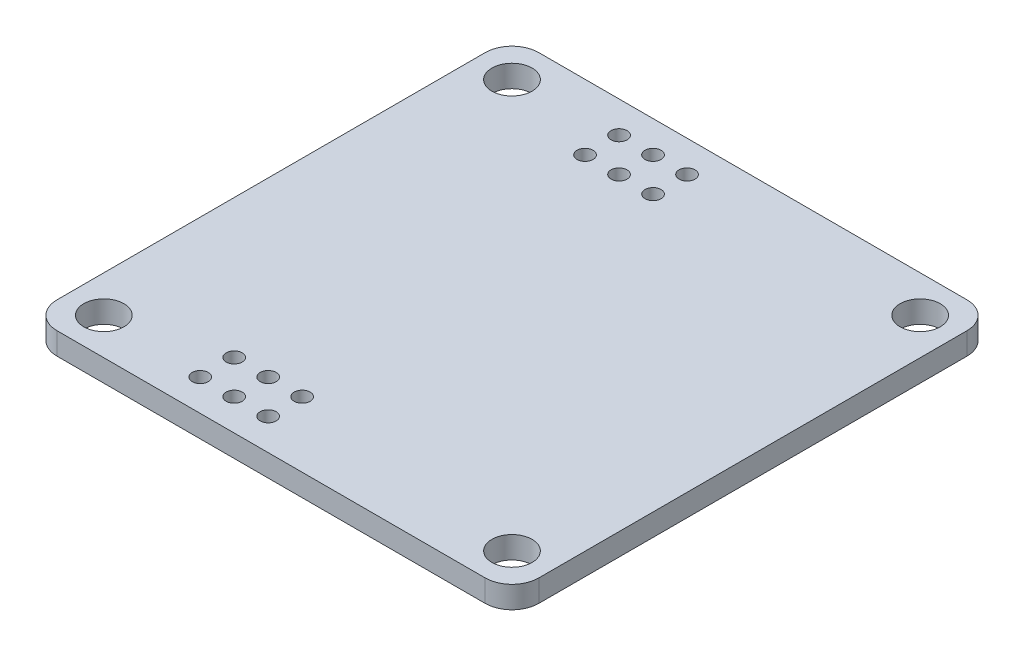
from build123d import *

# Parameters (mm, degrees)
SKETCH1_W             = 36
SKETCH1_H             = 36
SKETCH1_R             = 1.5
BASE_SHAPE_DEPTH      = 1.65
ROUNDED_CORNERS_R     = 2
PINHEADER_HOLES_REACH = 27.509
SKETCH2_R             = 0.6


with BuildPart() as part:
    # Sketch1 → Base shape (new body)
    with BuildSketch(Plane(origin=(0, 0, 0), x_dir=(1, 0, 0), z_dir=(0, 1, 0))):
        Rectangle(SKETCH1_W, SKETCH1_H)
        with Locations(Location((-15.25, 15.25, 0), (0, 0, 270))):
            Circle(SKETCH1_R, mode=Mode.SUBTRACT)
        with Locations(Location((15.25, 15.25, 0), (0, 0, 90))):
            Circle(SKETCH1_R, mode=Mode.SUBTRACT)
        with Locations(Location((15.25, -15.25, 0), (0, 0, 270))):
            Circle(SKETCH1_R, mode=Mode.SUBTRACT)
        with Locations(Location((-15.25, -15.25, 0), (0, 0, 90))):
            Circle(SKETCH1_R, mode=Mode.SUBTRACT)
    extrude(amount=BASE_SHAPE_DEPTH)

    # Rounded corners
    rounded_corners_edges = [part.edges().sort_by_distance(p)[0] for p in [
        (18, 0.825, 18),
        (-18, 0.825, 18),
        (-18, 0.825, -18),
        (18, 0.825, -18),
    ]]
    fillet(rounded_corners_edges, radius=ROUNDED_CORNERS_R)

    # Sketch2 → Pinheader holes (cut, up to next)
    with BuildSketch(Plane(origin=(0, 1.65, 0), x_dir=(1, 0, 0), z_dir=(0, 1, 0)), mode=Mode.PRIVATE) as pinheader_holes_sk1:
        with Locations(Location((-5.11, 15.65, 0), (0, 0, 270))):
            Circle(SKETCH2_R)
    pinheader_holes_tool1 = extrude(pinheader_holes_sk1.sketch, amount=-PINHEADER_HOLES_REACH, mode=Mode.PRIVATE) & part.part
    # Sketch2 → Pinheader holes (cut, up to next)
    with BuildSketch(Plane(origin=(0, 1.65, 0), x_dir=(1, 0, 0), z_dir=(0, 1, 0)), mode=Mode.PRIVATE) as pinheader_holes_sk2:
        with Locations(Location((-7.65, 15.65, 0), (0, 0, 270))):
            Circle(SKETCH2_R)
    pinheader_holes_tool2 = extrude(pinheader_holes_sk2.sketch, amount=-PINHEADER_HOLES_REACH, mode=Mode.PRIVATE) & part.part
    # Sketch2 → Pinheader holes (cut, up to next)
    with BuildSketch(Plane(origin=(0, 1.65, 0), x_dir=(1, 0, 0), z_dir=(0, 1, 0)), mode=Mode.PRIVATE) as pinheader_holes_sk3:
        with Locations(Location((-2.57, 15.65, 0), (0, 0, 270))):
            Circle(SKETCH2_R)
    pinheader_holes_tool3 = extrude(pinheader_holes_sk3.sketch, amount=-PINHEADER_HOLES_REACH, mode=Mode.PRIVATE) & part.part
    # Sketch2 → Pinheader holes (cut, up to next)
    with BuildSketch(Plane(origin=(0, 1.65, 0), x_dir=(1, 0, 0), z_dir=(0, 1, 0)), mode=Mode.PRIVATE) as pinheader_holes_sk4:
        with Locations(Location((-5.11, 13.11, 0), (0, 0, 270))):
            Circle(SKETCH2_R)
    pinheader_holes_tool4 = extrude(pinheader_holes_sk4.sketch, amount=-PINHEADER_HOLES_REACH, mode=Mode.PRIVATE) & part.part
    # Sketch2 → Pinheader holes (cut, up to next)
    with BuildSketch(Plane(origin=(0, 1.65, 0), x_dir=(1, 0, 0), z_dir=(0, 1, 0)), mode=Mode.PRIVATE) as pinheader_holes_sk5:
        with Locations(Location((-2.57, 13.11, 0), (0, 0, 270))):
            Circle(SKETCH2_R)
    pinheader_holes_tool5 = extrude(pinheader_holes_sk5.sketch, amount=-PINHEADER_HOLES_REACH, mode=Mode.PRIVATE) & part.part
    # Sketch2 → Pinheader holes (cut, up to next)
    with BuildSketch(Plane(origin=(0, 1.65, 0), x_dir=(1, 0, 0), z_dir=(0, 1, 0)), mode=Mode.PRIVATE) as pinheader_holes_sk6:
        with Locations(Location((-7.65, 13.11, 0), (0, 0, 270))):
            Circle(SKETCH2_R)
    pinheader_holes_tool6 = extrude(pinheader_holes_sk6.sketch, amount=-PINHEADER_HOLES_REACH, mode=Mode.PRIVATE) & part.part
    # Sketch2 → Pinheader holes (cut, up to next)
    with BuildSketch(Plane(origin=(0, 1.65, 0), x_dir=(1, 0, 0), z_dir=(0, 1, 0)), mode=Mode.PRIVATE) as pinheader_holes_sk7:
        with Locations(Location((-2.57, -13.11, 0), (0, 0, 270))):
            Circle(SKETCH2_R)
    pinheader_holes_tool7 = extrude(pinheader_holes_sk7.sketch, amount=-PINHEADER_HOLES_REACH, mode=Mode.PRIVATE) & part.part
    # Sketch2 → Pinheader holes (cut, up to next)
    with BuildSketch(Plane(origin=(0, 1.65, 0), x_dir=(1, 0, 0), z_dir=(0, 1, 0)), mode=Mode.PRIVATE) as pinheader_holes_sk8:
        with Locations(Location((-2.57, -15.65, 0), (0, 0, 270))):
            Circle(SKETCH2_R)
    pinheader_holes_tool8 = extrude(pinheader_holes_sk8.sketch, amount=-PINHEADER_HOLES_REACH, mode=Mode.PRIVATE) & part.part
    # Sketch2 → Pinheader holes (cut, up to next)
    with BuildSketch(Plane(origin=(0, 1.65, 0), x_dir=(1, 0, 0), z_dir=(0, 1, 0)), mode=Mode.PRIVATE) as pinheader_holes_sk9:
        with Locations(Location((-5.11, -13.11, 0), (0, 0, 270))):
            Circle(SKETCH2_R)
    pinheader_holes_tool9 = extrude(pinheader_holes_sk9.sketch, amount=-PINHEADER_HOLES_REACH, mode=Mode.PRIVATE) & part.part
    # Sketch2 → Pinheader holes (cut, up to next)
    with BuildSketch(Plane(origin=(0, 1.65, 0), x_dir=(1, 0, 0), z_dir=(0, 1, 0)), mode=Mode.PRIVATE) as pinheader_holes_sk10:
        with Locations(Location((-5.11, -15.65, 0), (0, 0, 270))):
            Circle(SKETCH2_R)
    pinheader_holes_tool10 = extrude(pinheader_holes_sk10.sketch, amount=-PINHEADER_HOLES_REACH, mode=Mode.PRIVATE) & part.part
    # Sketch2 → Pinheader holes (cut, up to next)
    with BuildSketch(Plane(origin=(0, 1.65, 0), x_dir=(1, 0, 0), z_dir=(0, 1, 0)), mode=Mode.PRIVATE) as pinheader_holes_sk11:
        with Locations(Location((-7.65, -13.11, 0), (0, 0, 270))):
            Circle(SKETCH2_R)
    pinheader_holes_tool11 = extrude(pinheader_holes_sk11.sketch, amount=-PINHEADER_HOLES_REACH, mode=Mode.PRIVATE) & part.part
    # Sketch2 → Pinheader holes (cut, up to next)
    with BuildSketch(Plane(origin=(0, 1.65, 0), x_dir=(1, 0, 0), z_dir=(0, 1, 0)), mode=Mode.PRIVATE) as pinheader_holes_sk12:
        with Locations(Location((-7.65, -15.65, 0), (0, 0, 270))):
            Circle(SKETCH2_R)
    pinheader_holes_tool12 = extrude(pinheader_holes_sk12.sketch, amount=-PINHEADER_HOLES_REACH, mode=Mode.PRIVATE) & part.part
    add(pinheader_holes_tool1.solids().sort_by_distance((-5.11, 1.65, -15.65))[0], mode=Mode.SUBTRACT)
    add(pinheader_holes_tool2.solids().sort_by_distance((-7.65, 1.65, -15.65))[0], mode=Mode.SUBTRACT)
    add(pinheader_holes_tool3.solids().sort_by_distance((-2.57, 1.65, -15.65))[0], mode=Mode.SUBTRACT)
    add(pinheader_holes_tool4.solids().sort_by_distance((-5.11, 1.65, -13.11))[0], mode=Mode.SUBTRACT)
    add(pinheader_holes_tool5.solids().sort_by_distance((-2.57, 1.65, -13.11))[0], mode=Mode.SUBTRACT)
    add(pinheader_holes_tool6.solids().sort_by_distance((-7.65, 1.65, -13.11))[0], mode=Mode.SUBTRACT)
    add(pinheader_holes_tool7.solids().sort_by_distance((-2.57, 1.65, 13.11))[0], mode=Mode.SUBTRACT)
    add(pinheader_holes_tool8.solids().sort_by_distance((-2.57, 1.65, 15.65))[0], mode=Mode.SUBTRACT)
    add(pinheader_holes_tool9.solids().sort_by_distance((-5.11, 1.65, 13.11))[0], mode=Mode.SUBTRACT)
    add(pinheader_holes_tool10.solids().sort_by_distance((-5.11, 1.65, 15.65))[0], mode=Mode.SUBTRACT)
    add(pinheader_holes_tool11.solids().sort_by_distance((-7.65, 1.65, 13.11))[0], mode=Mode.SUBTRACT)
    add(pinheader_holes_tool12.solids().sort_by_distance((-7.65, 1.65, 15.65))[0], mode=Mode.SUBTRACT)


solid = part.part
